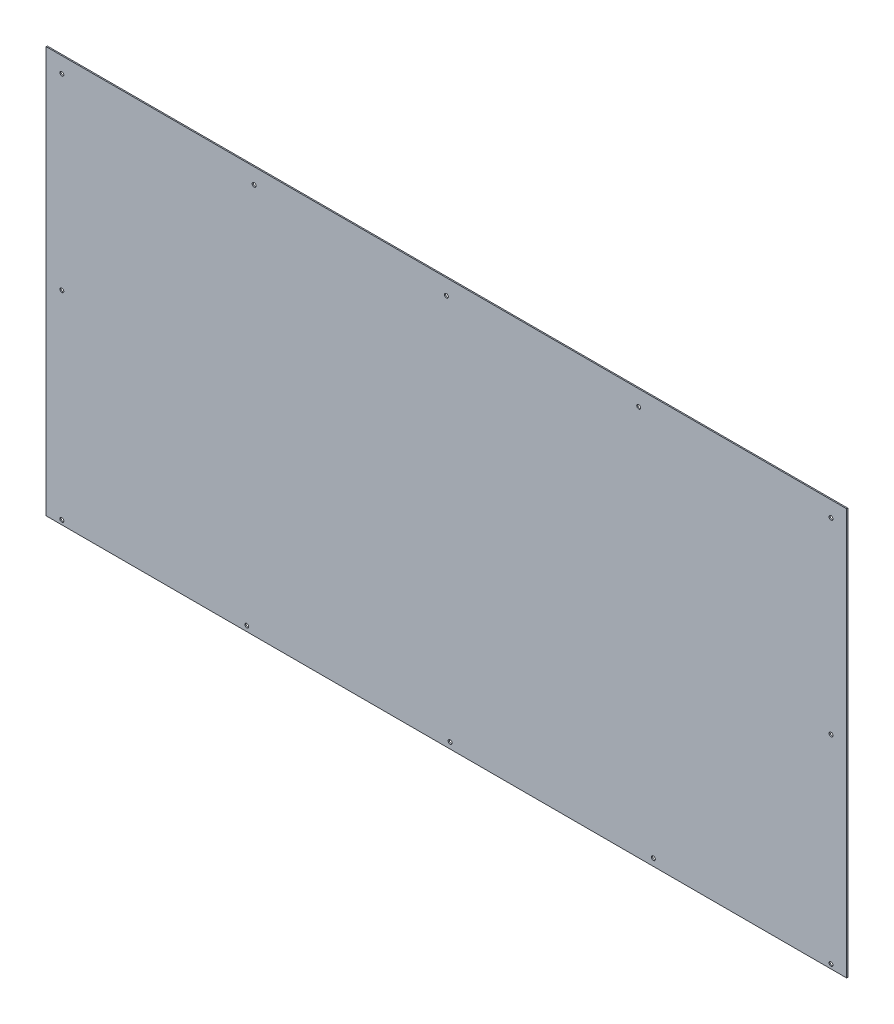
from build123d import *

# Parameters (mm, degrees)
CROQUIS1_W              = 1300
CROQUIS1_H              = 660
SALIENTE_EXTRUIR1_DEPTH = 1.9
CROQUIS2_R              = 3.175
CORTAR_EXTRUIR2_DEPTH   = 6.35
CROQUIS4_R              = 3.175
CORTAR_EXTRUIR3_DEPTH   = 10


with BuildPart() as part:
    # Croquis1 → Saliente-Extruir1 (new body)
    with BuildSketch(Plane.XY):
        Rectangle(CROQUIS1_W, CROQUIS1_H)
    extrude(amount=SALIENTE_EXTRUIR1_DEPTH)

    # Croquis2 → Cortar-Extruir2 (cut)
    with BuildSketch(Plane.XY.offset(1.9)):
        with Locations((-624.6, 304.6)):
            Circle(CROQUIS2_R)
        with Locations((0, 304.6)):
            Circle(CROQUIS2_R)
        with Locations((624.6, 304.6)):
            Circle(CROQUIS2_R)
        with Locations((-312.3, 304.6)):
            Circle(CROQUIS2_R)
        with Locations((312.3, 304.6)):
            Circle(CROQUIS2_R)
        with Locations((-624.6, 0)):
            Circle(CROQUIS2_R)
        with Locations((624.6, 0)):
            Circle(CROQUIS2_R)
        with Locations((-624.6, -323)):
            Circle(CROQUIS2_R)
        with Locations((624.6, -323)):
            Circle(CROQUIS2_R)
    extrude(amount=-CORTAR_EXTRUIR2_DEPTH, mode=Mode.SUBTRACT)

    # Croquis4 → Cortar-Extruir3 (cut)
    with BuildSketch(Plane(origin=(0, 0, 0), x_dir=(-1, 0, 0), z_dir=(0, 0, -1))):
        with Locations((324.3, -321.56006501)):
            Circle(CROQUIS4_R)
        with Locations((-6, -319.97628037)):
            Circle(CROQUIS4_R)
        with Locations((-336.3, -318.392495731)):
            Circle(CROQUIS4_R)
    extrude(amount=-CORTAR_EXTRUIR3_DEPTH, mode=Mode.SUBTRACT)


solid = part.part
